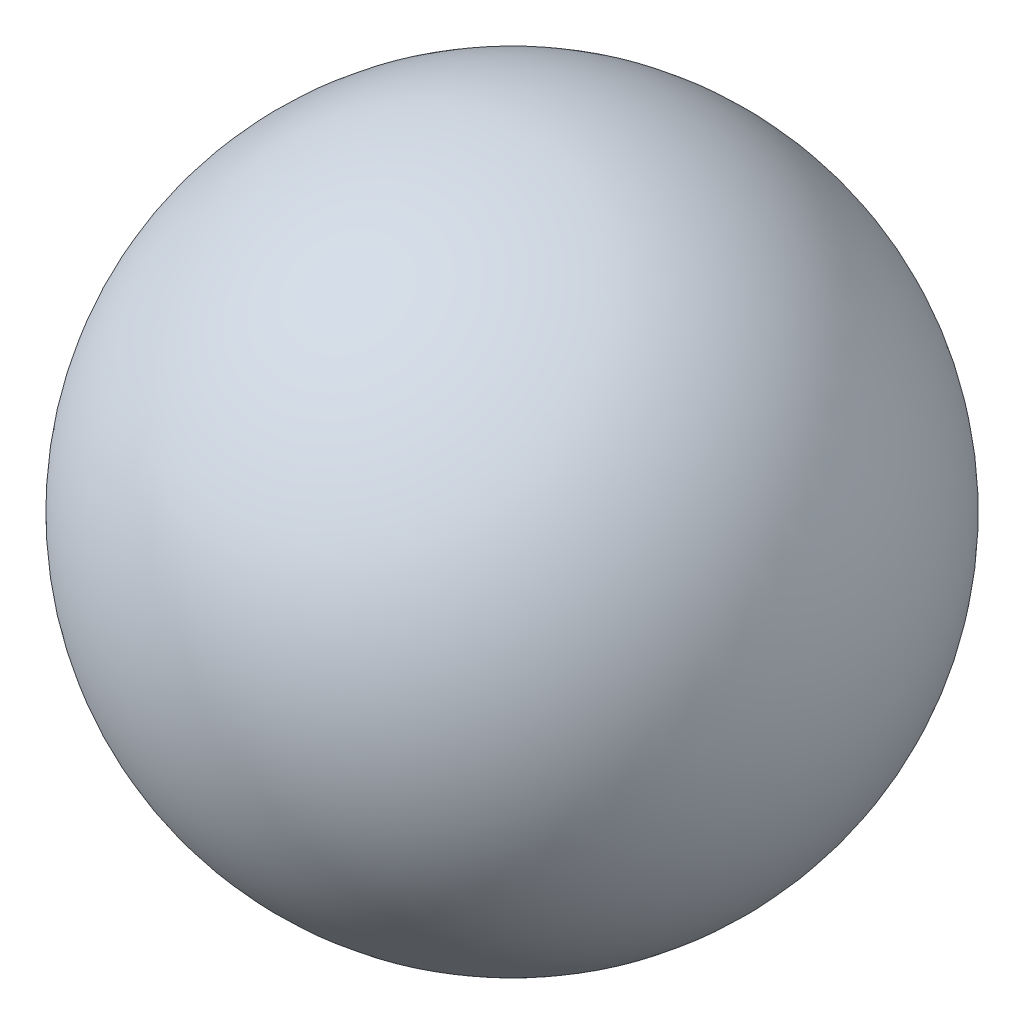
from build123d import *


with BuildPart() as part:
    # Croquis1 → Revolución1 (revolve)
    with BuildSketch(Plane.XY):
        with BuildLine():
            Line((0, 1.5), (0, 0))
            ThreePointArc((0, 0), (0.75, 0.75), (0, 1.5))
        make_face()
    revolve(axis=Axis((0, 1.5, 0), (0, -1, 0)))


solid = part.part
